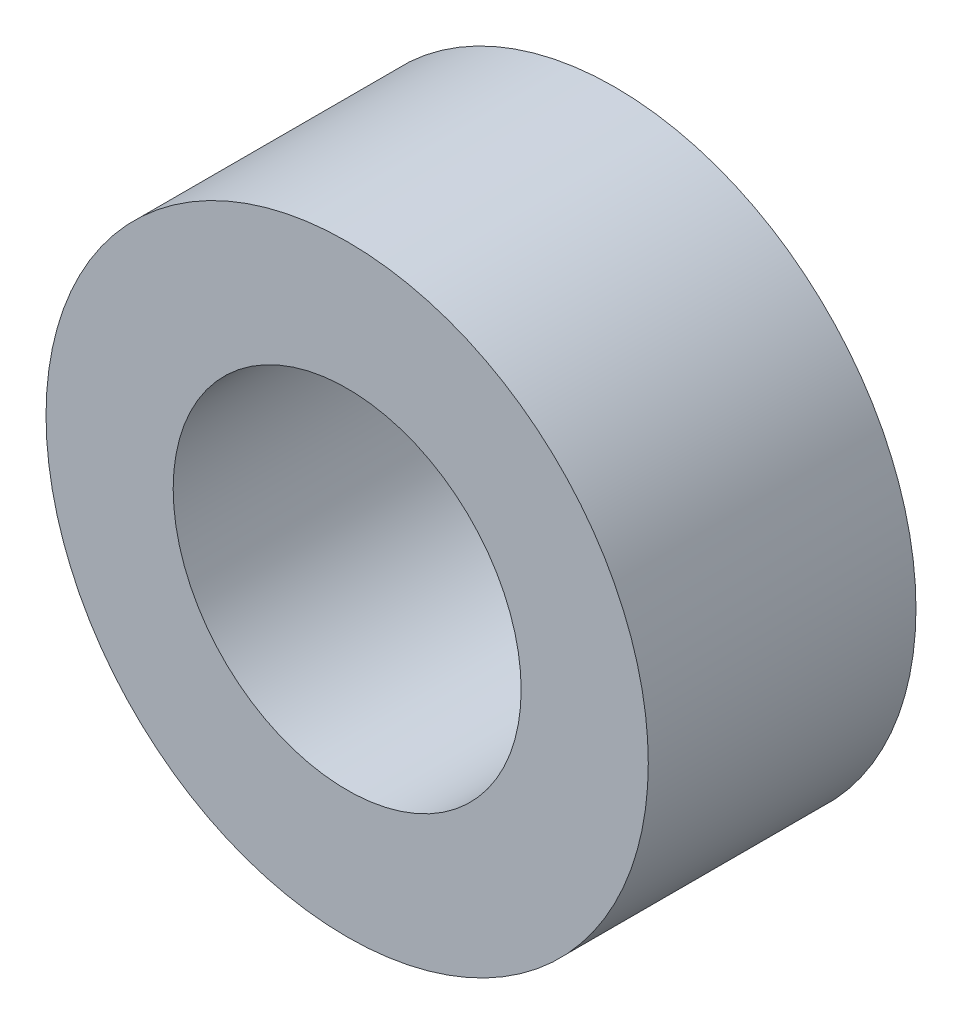
from build123d import *

# Parameters (mm, degrees)
SKETCH1_R           = 4.5
BOSS_EXTRUDE1_DEPTH = 4
SKETCH2_R           = 2.6
CUT_EXTRUDE1_DEPTH  = 8.516648189


with BuildPart() as part:
    # Sketch1 → Boss-Extrude1 (new body)
    with BuildSketch(Plane.XY):
        Circle(SKETCH1_R)
    extrude(amount=BOSS_EXTRUDE1_DEPTH)

    # Sketch2 → Cut-Extrude1 (cut, through all)
    with BuildSketch(Plane.XY.offset(4)):
        Circle(SKETCH2_R)
    extrude(amount=-CUT_EXTRUDE1_DEPTH, mode=Mode.SUBTRACT)


solid = part.part
